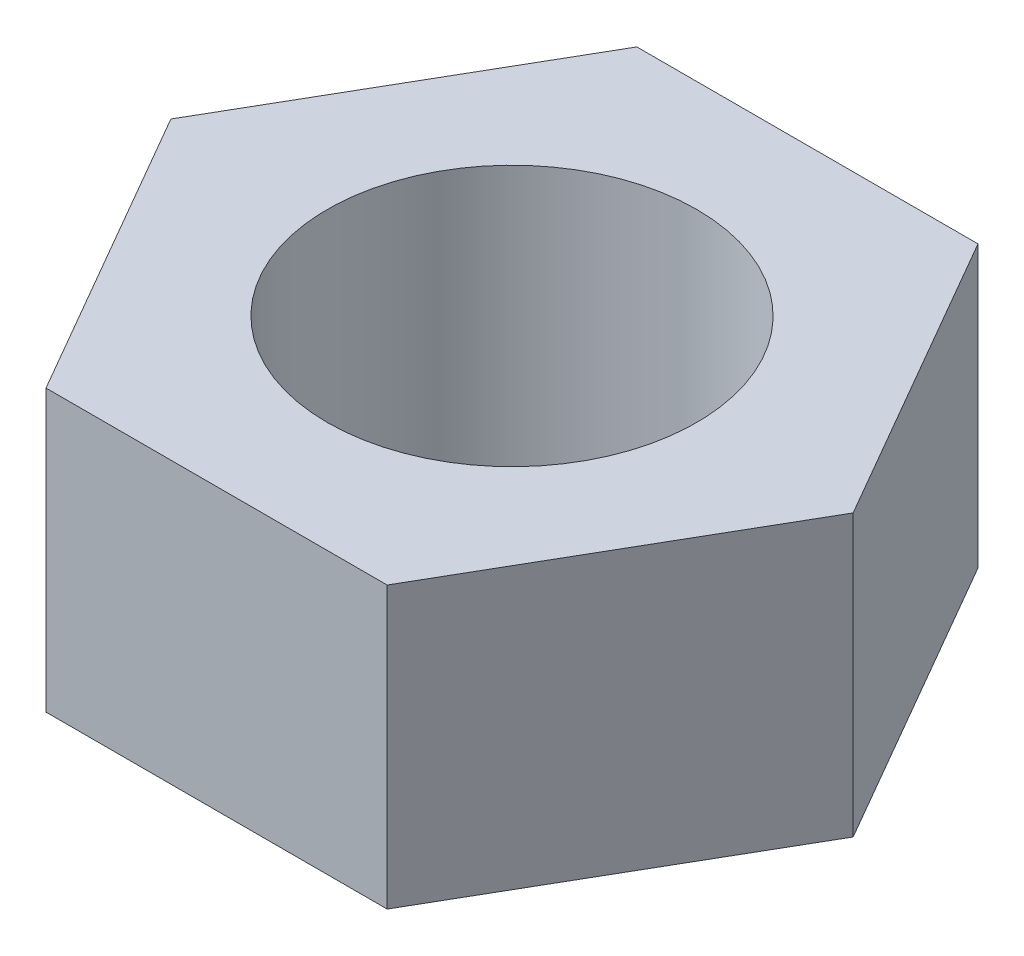
from build123d import *

# Parameters (mm, degrees)
BOSS_EXTRUDE1_DEPTH = 3.8
SKETCH2_R           = 2.5
CUT_EXTRUDE1_DEPTH  = 8.195368881


with BuildPart() as part:
    # Sketch1 → Boss-Extrude1 (new body)
    with BuildSketch(Plane(origin=(0, 0, 0), x_dir=(1, 0, 0), z_dir=(0, 1, 0))):
        Polygon((4.618802154, 0), (2.309401077, 4), (-2.309401077, 4), (-4.618802154, 0), (-2.309401077, -4), (2.309401077, -4), align=None)
    extrude(amount=BOSS_EXTRUDE1_DEPTH)

    # Sketch2 → Cut-Extrude1 (cut, through all)
    with BuildSketch(Plane.XZ):
        with Locations(Location((0, 0, 0), (0, 0, 270))):
            Circle(SKETCH2_R)
    extrude(amount=-CUT_EXTRUDE1_DEPTH, mode=Mode.SUBTRACT)


solid = part.part
